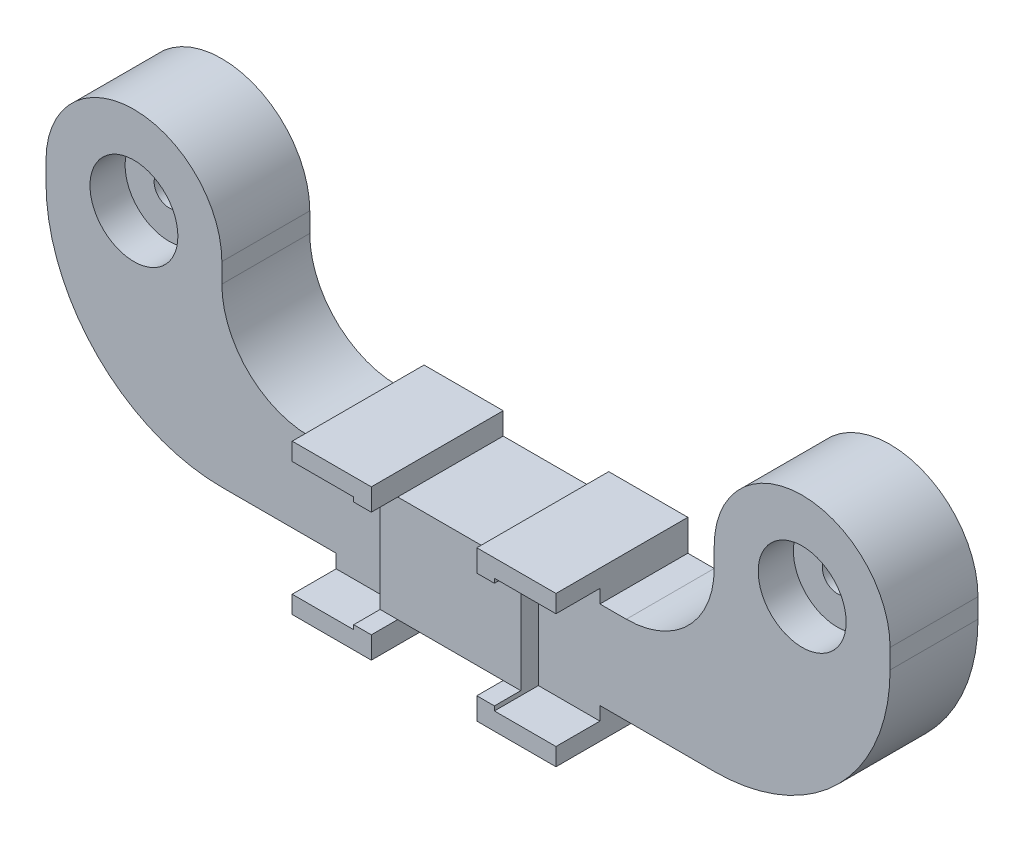
from build123d import *

# Parameters (mm, degrees)
SKETCH1_R           = 5
SKETCH1_R_2         = 1.7
BOSS_EXTRUDE1_DEPTH = 10
SKETCH1_4_R         = 5
SKETCH1_4_R_2       = 1.7
CUT_EXTRUDE1_DEPTH  = 4
SKETCH3_W           = 6
SKETCH3_H           = 1.0375
SKETCH3_W_2         = 2
BOSS_EXTRUDE2_DEPTH = 10
BOSS_EXTRUDE3_DEPTH = 5
SKETCH3_4_W         = 2
SKETCH3_4_H         = 10
SKETCH3_4_W_2       = 6
SKETCH3_4_H_2       = 1.0375
BOSS_EXTRUDE4_DEPTH = 2


with BuildPart() as part:
    # Sketch1 → Boss-Extrude1 (new body)
    # profile 1 of 4: a face of its own
    with BuildSketch(Plane.XY):
        with BuildLine():
            Line((-48, 22.22), (-48, 20))
            ThreePointArc((-48, 20), (-42.142135624, 5.857864376), (-28, 0))
            Line((-28, 0), (0, 0))
            Line((0, 0), (0, 10))
            Line((0, 10), (-18, 10))
            ThreePointArc((-18, 10), (-25.071067812, 12.928932188), (-28, 20))
            Line((-28, 20), (-28, 22.22))
            ThreePointArc((-28, 22.22), (-38, 32.22), (-48, 22.22))
        make_face()
        with Locations((-38, 22.22)):
            Circle(SKETCH1_R, mode=Mode.SUBTRACT)
    # profile 2 of 4: a face of its own
    with BuildSketch(Plane.XY):
        with Locations((-38, 22.22)):
            Circle(SKETCH1_R)
        with Locations((-38, 22.22)):
            Circle(SKETCH1_R_2, mode=Mode.SUBTRACT)
    # profile 3 of 4: a face of its own
    with BuildSketch(Plane.XY):
        with BuildLine():
            Line((0, 10), (0, 0))
            Line((0, 0), (28, 0))
            ThreePointArc((28, 0), (42.142135624, 5.857864376), (48, 20))
            Line((48, 20), (48, 22.22))
            ThreePointArc((48, 22.22), (38, 32.22), (28, 22.22))
            Line((28, 22.22), (28, 20))
            ThreePointArc((28, 20), (25.071067812, 12.928932188), (18, 10))
            Line((18, 10), (0, 10))
        make_face()
        with Locations((38, 22.22)):
            Circle(SKETCH1_R, mode=Mode.SUBTRACT)
    # profile 4 of 4: a face of its own
    with BuildSketch(Plane.XY):
        with Locations((38, 22.22)):
            Circle(SKETCH1_R)
        with Locations((38, 22.22)):
            Circle(SKETCH1_R_2, mode=Mode.SUBTRACT)
    extrude(amount=-BOSS_EXTRUDE1_DEPTH)

    # Sketch1<4> → Cut-Extrude1 (cut)
    # profile 1 of 2: a face of its own
    with BuildSketch(Plane.XY):
        with Locations((-38, 22.22)):
            Circle(SKETCH1_4_R)
        with Locations((-38, 22.22)):
            Circle(SKETCH1_4_R_2, mode=Mode.SUBTRACT)
    # profile 2 of 2: a face of its own
    with BuildSketch(Plane.XY):
        with Locations((38, 22.22)):
            Circle(SKETCH1_4_R)
        with Locations((38, 22.22)):
            Circle(SKETCH1_4_R_2, mode=Mode.SUBTRACT)
    extrude(amount=-CUT_EXTRUDE1_DEPTH, mode=Mode.SUBTRACT)

    # Sketch3 → Boss-Extrude2 (add, through all)
    with BuildSketch(Plane.XY):
        with Locations((-3, 10.51875)):
            Rectangle(SKETCH3_W, SKETCH3_H)
        with Locations((3, 10.51875)):
            Rectangle(SKETCH3_W, SKETCH3_H)
        with Locations((-3, -0.51875)):
            Rectangle(SKETCH3_W, SKETCH3_H)
        with Locations((3, -0.51875)):
            Rectangle(SKETCH3_W, SKETCH3_H)
        with Locations((-7, 10.51875)):
            Rectangle(SKETCH3_W_2, SKETCH3_H)
        Polygon((-15, 10), (-8, 10), (-8, 11.0375), (-8, 11.5375), (-15, 11.5375), align=None)
        Polygon((-8, 11.0375), (-6, 11.0375), (-6, 13.5375), (-15, 13.5375), (-15, 11.5375), (-8, 11.5375), align=None)
        Polygon((-6, -3.5375), (-6, -1.0375), (-8, -1.0375), (-8, -1.5375), (-15, -1.5375), (-15, -3.5375), align=None)
        with Locations((-7, -0.51875)):
            Rectangle(SKETCH3_W_2, SKETCH3_H)
        with Locations((7, -0.51875)):
            Rectangle(SKETCH3_W_2, SKETCH3_H)
        Polygon((8, -1.0375), (6, -1.0375), (6, -3.5375), (15, -3.5375), (15, -1.5375), (8, -1.5375), align=None)
        Polygon((8, 0), (8, -1.0375), (8, -1.5375), (15, -1.5375), (15, 0), align=None)
        Polygon((8, 11.0375), (8, 10), (15, 10), (15, 11.5375), (8, 11.5375), align=None)
        with Locations((7, 10.51875)):
            Rectangle(SKETCH3_W_2, SKETCH3_H)
        Polygon((6, 13.5375), (6, 11.0375), (8, 11.0375), (8, 11.5375), (15, 11.5375), (15, 13.5375), align=None)
        Polygon((-8, -1.5375), (-8, -1.0375), (-8, 0), (-15, 0), (-15, -1.5375), align=None)
    extrude(amount=-BOSS_EXTRUDE2_DEPTH)

    # Sketch3<3> → Boss-Extrude3 (add)
    with BuildSketch(Plane.XY):
        Polygon((-8, 11.0375), (-6, 11.0375), (-6, 13.5375), (-15, 13.5375), (-15, 11.5375), (-8, 11.5375), align=None)
        Polygon((-6, -3.5375), (-6, -1.0375), (-8, -1.0375), (-8, -1.5375), (-15, -1.5375), (-15, -3.5375), align=None)
        Polygon((8, -1.0375), (6, -1.0375), (6, -3.5375), (15, -3.5375), (15, -1.5375), (8, -1.5375), align=None)
        Polygon((6, 13.5375), (6, 11.0375), (8, 11.0375), (8, 11.5375), (15, 11.5375), (15, 13.5375), align=None)
    extrude(amount=BOSS_EXTRUDE3_DEPTH)

    # Sketch3<4> → Boss-Extrude4 (add)
    with BuildSketch(Plane.XY):
        with Locations((-7, 5)):
            Rectangle(SKETCH3_4_W, SKETCH3_4_H)
        with Locations((-3, 5)):
            Rectangle(SKETCH3_4_W_2, SKETCH3_4_H)
        with Locations((7, 5)):
            Rectangle(SKETCH3_4_W, SKETCH3_4_H)
        with Locations((3, 5)):
            Rectangle(SKETCH3_4_W_2, SKETCH3_4_H)
        with Locations((3, 10.51875)):
            Rectangle(SKETCH3_4_W_2, SKETCH3_4_H_2)
        with Locations((7, 10.51875)):
            Rectangle(SKETCH3_4_W, SKETCH3_4_H_2)
        with Locations((-3, 10.51875)):
            Rectangle(SKETCH3_4_W_2, SKETCH3_4_H_2)
        with Locations((-7, 10.51875)):
            Rectangle(SKETCH3_4_W, SKETCH3_4_H_2)
        with Locations((-7, -0.51875)):
            Rectangle(SKETCH3_4_W, SKETCH3_4_H_2)
        with Locations((-3, -0.51875)):
            Rectangle(SKETCH3_4_W_2, SKETCH3_4_H_2)
        with Locations((3, -0.51875)):
            Rectangle(SKETCH3_4_W_2, SKETCH3_4_H_2)
        with Locations((7, -0.51875)):
            Rectangle(SKETCH3_4_W, SKETCH3_4_H_2)
    extrude(amount=BOSS_EXTRUDE4_DEPTH)


solid = part.part
